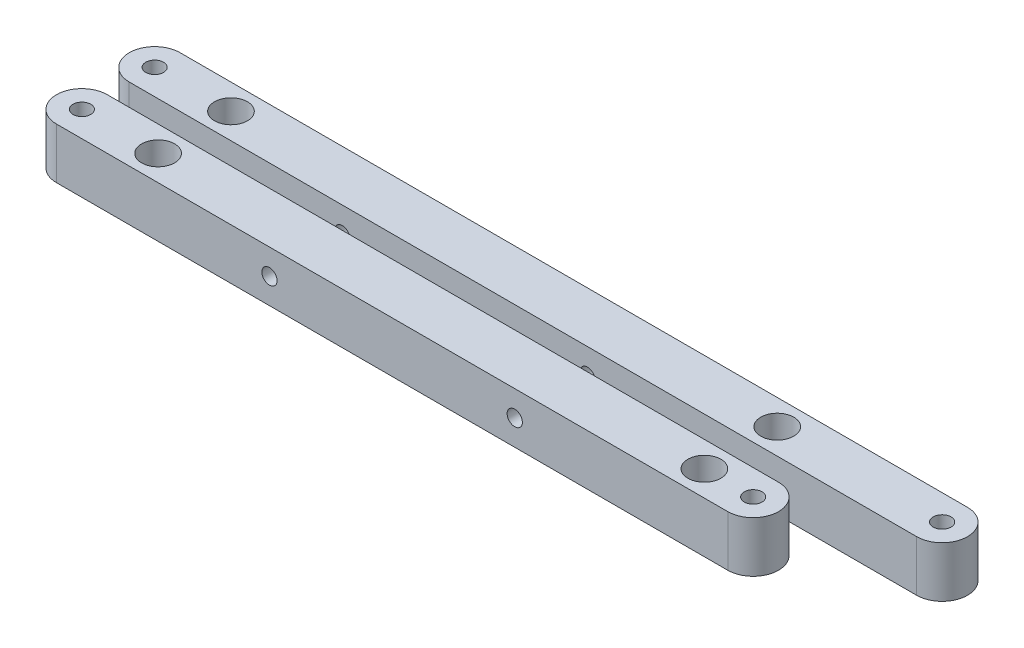
from build123d import *

# Parameters (mm, degrees)
SKETCH1_R             = 1.75
BOSS_EXTRUDE1_DEPTH   = 10
BOSS_EXTRUDE1_2_DEPTH = 10
SKETCH2_R             = 1.5
CUT_EXTRUDE1_DEPTH    = 179.835360122
SKETCH4_R             = 3.25
CUT_EXTRUDE2_DEPTH    = 8


with BuildPart() as part:
    # Sketch1 → Boss-Extrude1 (new body)
    with BuildSketch(Plane(origin=(0, 0, 0), x_dir=(1, 0, 0), z_dir=(0, 1, 0))):
        with BuildLine():
            Line((16.951711967, 18.791545065), (171.891711967, 18.791545065))
            ThreePointArc((171.891711967, 18.791545065), (176.891711967, 13.791545065), (171.891711967, 8.791545065))
            Line((171.891711967, 8.791545065), (16.951711967, 8.791545065))
            ThreePointArc((16.951711967, 8.791545065), (11.951711967, 13.791545065), (16.951711967, 18.791545065))
        make_face()
        with Locations(Location((16.951711967, 13.791545065, 0), (0, 0, 270))):
            Circle(SKETCH1_R, mode=Mode.SUBTRACT)
        with Locations(Location((31.951711967, 13.810297164, 0), (0, 0, 270))):
            Circle(SKETCH1_R, mode=Mode.SUBTRACT)
        with Locations(Location((139.431711967, 13.810297164, 0), (0, 0, 270))):
            Circle(SKETCH1_R, mode=Mode.SUBTRACT)
        with Locations(Location((171.891711967, 13.791545065, 0), (0, 0, 270))):
            Circle(SKETCH1_R, mode=Mode.SUBTRACT)
    extrude(amount=BOSS_EXTRUDE1_DEPTH)


with BuildPart() as body_2:
    # Sketch1 → Boss-Extrude1 2 (new body)
    with BuildSketch(Plane(origin=(0, 0, 0), x_dir=(1, 0, 0), z_dir=(0, 1, 0))):
        with BuildLine():
            Line((16.951711967, 4.472658016), (149.031711967, 4.472658016))
            ThreePointArc((149.031711967, 4.472658016), (154.031711967, -0.527341984), (149.031711967, -5.527341984))
            Line((149.031711967, -5.527341984), (16.951711967, -5.527341984))
            ThreePointArc((16.951711967, -5.527341984), (11.951711967, -0.527341984), (16.951711967, 4.472658016))
        make_face()
        with Locations(Location((16.951711967, -0.527341984, 0), (0, 0, 270))):
            Circle(SKETCH1_R, mode=Mode.SUBTRACT)
        with Locations(Location((31.951711967, -0.527341984, 0), (0, 0, 270))):
            Circle(SKETCH1_R, mode=Mode.SUBTRACT)
        with Locations(Location((139.431711967, -0.527341984, 0), (0, 0, 270))):
            Circle(SKETCH1_R, mode=Mode.SUBTRACT)
        with Locations(Location((149.031711967, -0.527341984, 0), (0, 0, 270))):
            Circle(SKETCH1_R, mode=Mode.SUBTRACT)
    extrude(amount=BOSS_EXTRUDE1_2_DEPTH)


with BuildPart() as cut_extrude1_tool:
    # Sketch2 → Cut-Extrude1 (new, through all)
    with BuildSketch(Plane.XY.offset(5.527341984)):
        with Locations((58.861711967, 5)):
            Circle(SKETCH2_R)
        with Locations((107.121711967, 5)):
            Circle(SKETCH2_R)
    extrude(amount=-CUT_EXTRUDE1_DEPTH)


with BuildPart() as part_1:
    add(part.part)

    # Cut-Extrude1: cut by cut_extrude1_tool
    add(cut_extrude1_tool.part, mode=Mode.SUBTRACT)


with BuildPart() as body_2_1:
    add(body_2.part)

    # Cut-Extrude1: cut by cut_extrude1_tool
    add(cut_extrude1_tool.part, mode=Mode.SUBTRACT)


with BuildPart() as cut_extrude2_tool:
    # Sketch4 → Cut-Extrude2 (new body)
    with BuildSketch(Plane(origin=(0, 10, 0), x_dir=(1, 0, 0), z_dir=(0, 1, 0))):
        with Locations(Location((31.951711967, 13.810297164, 0), (0, 0, 270))):
            Circle(SKETCH4_R)
        with Locations(Location((31.951711967, -0.527341984, 0), (0, 0, 270))):
            Circle(SKETCH4_R)
        with Locations(Location((139.431711967, -0.527341984, 0), (0, 0, 270))):
            Circle(SKETCH4_R)
        with Locations(Location((139.431711967, 13.810297164, 0), (0, 0, 270))):
            Circle(SKETCH4_R)
    extrude(amount=-CUT_EXTRUDE2_DEPTH)


with BuildPart() as part_2:
    add(part_1.part)

    # Cut-Extrude2: cut by cut_extrude2_tool
    add(cut_extrude2_tool.part, mode=Mode.SUBTRACT)


with BuildPart() as body_2_2:
    add(body_2_1.part)

    # Cut-Extrude2: cut by cut_extrude2_tool
    add(cut_extrude2_tool.part, mode=Mode.SUBTRACT)


solid = Compound([part_2.part, body_2_2.part])
